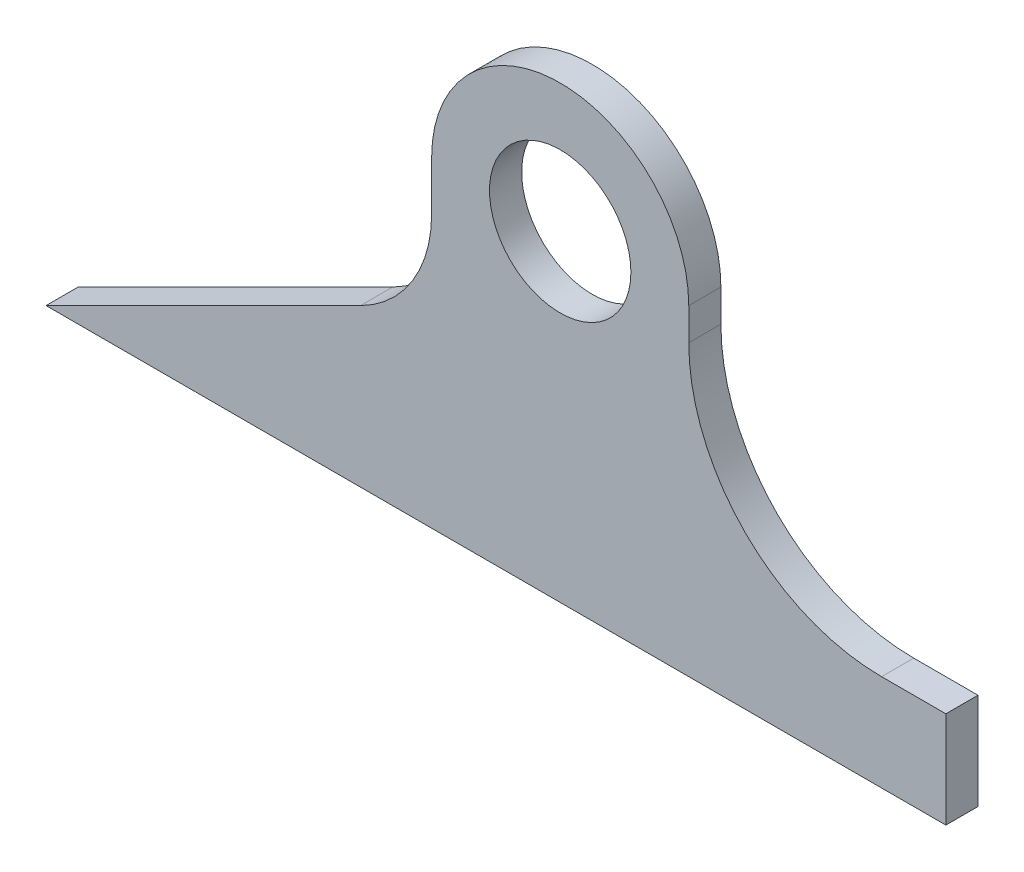
from build123d import *

# Parameters (mm, degrees)
SKETCH1_R           = 11
BOSS_EXTRUDE1_DEPTH = 5


with BuildPart() as part:
    # Sketch1 → Boss-Extrude1 (new body)
    with BuildSketch(Plane.XY):
        with BuildLine():
            Line((-40, -16.647753155), (-100, -16.647753155))
            Line((-100, -16.647753155), (-51.05572809, 7.8243828))
            ThreePointArc((-51.05572809, 7.8243828), (-42.986983833, 15.198304378), (-40, 25.71292662))
            Line((-40, 25.71292662), (-40, 33.352246845))
            ThreePointArc((-40, 33.352246845), (-20.000000263, 53.352247372), (0, 33.352247372))
            Line((0, 33.352247372), (0, 28.352246845))
            ThreePointArc((0, 28.352246845), (8.786796564, 7.139043409), (30, -1.647753155))
            Line((30, -1.647753155), (40, -1.647753155))
            Line((40, -1.647753155), (40, -16.647753155))
            Line((40, -16.647753155), (-40, -16.647753155))
        make_face()
        with Locations((-20, 33.352247372)):
            Circle(SKETCH1_R, mode=Mode.SUBTRACT)
    extrude(amount=BOSS_EXTRUDE1_DEPTH)


solid = part.part
